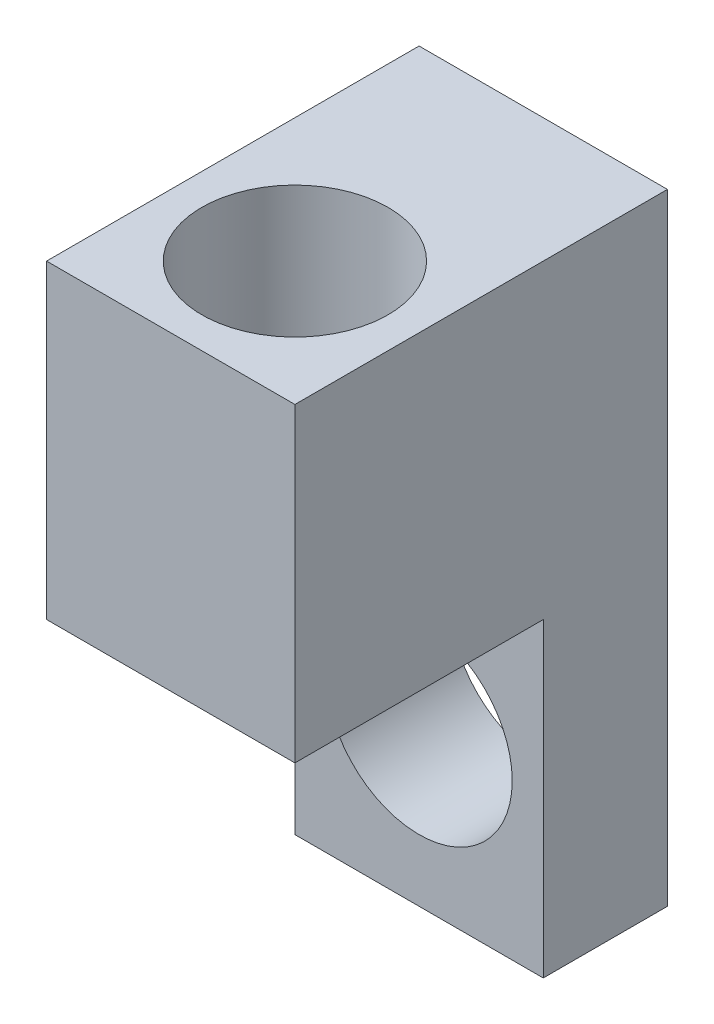
from build123d import *

# Parameters (mm, degrees)
ESQUISSE1_W             = 8
ESQUISSE1_H             = 20
BOSS_EXTRU_1_DEPTH      = 12
ESQUISSE2_W             = 8
ESQUISSE2_H             = 10
ENL_V_MAT_EXTRU_1_DEPTH = 8
ESQUISSE3_R             = 3
ENL_V_MAT_EXTRU_2_DEPTH = 10
ESQUISSE4_R             = 3
ENL_V_MAT_EXTRU_3_DEPTH = 4


with BuildPart() as part:
    # Esquisse1 → Boss.-Extru.1 (new body)
    with BuildSketch(Plane.XY):
        Rectangle(ESQUISSE1_W, ESQUISSE1_H)
    extrude(amount=BOSS_EXTRU_1_DEPTH)

    # Esquisse2 → Enlèv. mat.-Extru.1 (cut)
    with BuildSketch(Plane.ZY.offset(4)):
        with Locations((8, -5)):
            Rectangle(ESQUISSE2_W, ESQUISSE2_H)
    extrude(amount=-ENL_V_MAT_EXTRU_1_DEPTH, mode=Mode.SUBTRACT)

    # Esquisse3 → Enlèv. mat.-Extru.2 (cut)
    with BuildSketch(Plane.XZ):
        with Locations(Location((0, 8, 0), (0, 0, 270))):
            Circle(ESQUISSE3_R)
    extrude(amount=-ENL_V_MAT_EXTRU_2_DEPTH, mode=Mode.SUBTRACT)

    # Esquisse4 → Enlèv. mat.-Extru.3 (cut)
    with BuildSketch(Plane.XY.offset(4)):
        with Locations((0, -5)):
            Circle(ESQUISSE4_R)
    extrude(amount=-ENL_V_MAT_EXTRU_3_DEPTH, mode=Mode.SUBTRACT)


solid = part.part
